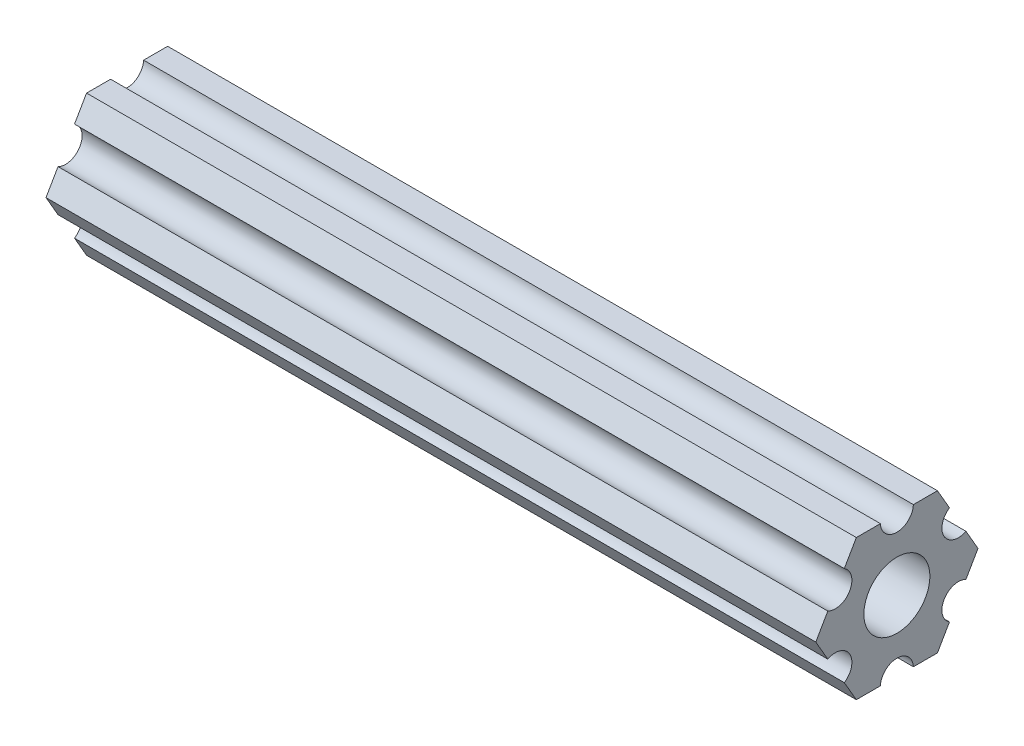
from build123d import *

# Parameters (mm, degrees)
BOSS_EXTRUDE1_START = -34.064
SKETCH2_R           = 2.921
BOSS_EXTRUDE1_DEPTH = 68.128


with BuildPart() as part:
    # Sketch2 → Boss-Extrude1 (new body)
    with BuildSketch(Plane(origin=(0, 0, 0), x_dir=(0, 0, -1), z_dir=(1, 0, 0)).offset(BOSS_EXTRUDE1_START)):
        with BuildLine():
            Line((-1.82176, 39.714214029), (-3.950444551, 39.714214029))
            ThreePointArc((-3.950444551, 39.714214029), (-5.410944551, 38.323564029), (-6.871444551, 39.714214029))
            Line((-6.871444551, 39.714214029), (-9.000129101, 39.714214029))
            Line((-9.000129101, 39.714214029), (-10.064471377, 37.870719131))
            ThreePointArc((-10.064471377, 37.870719131), (-9.590383149, 35.910564029), (-11.524971377, 35.341058926))
            Line((-11.524971377, 35.341058926), (-12.589313652, 33.497564029))
            Line((-12.589313652, 33.497564029), (-11.524971377, 31.654069131))
            ThreePointArc((-11.524971377, 31.654069131), (-9.590383149, 31.084564029), (-10.064471377, 29.124408926))
            Line((-10.064471377, 29.124408926), (-9.000129101, 27.280914029))
            Line((-9.000129101, 27.280914029), (-6.871444551, 27.280914029))
            ThreePointArc((-6.871444551, 27.280914029), (-5.410944551, 28.671564029), (-3.950444551, 27.280914029))
            Line((-3.950444551, 27.280914029), (-1.82176, 27.280914029))
            Line((-1.82176, 27.280914029), (-0.757417724, 29.124408926))
            ThreePointArc((-0.757417724, 29.124408926), (-1.231505952, 31.084564029), (0.703082276, 31.654069131))
            Line((0.703082276, 31.654069131), (1.767424551, 33.497564029))
            Line((1.767424551, 33.497564029), (0.703082276, 35.341058926))
            ThreePointArc((0.703082276, 35.341058926), (-1.231505952, 35.910564029), (-0.757417724, 37.870719131))
            Line((-0.757417724, 37.870719131), (-1.82176, 39.714214029))
        make_face()
        with Locations(Location((-5.410944551, 33.497564029, 0), (0, 0, 180))):
            Circle(SKETCH2_R, mode=Mode.SUBTRACT)
    extrude(amount=BOSS_EXTRUDE1_DEPTH)


solid = part.part
